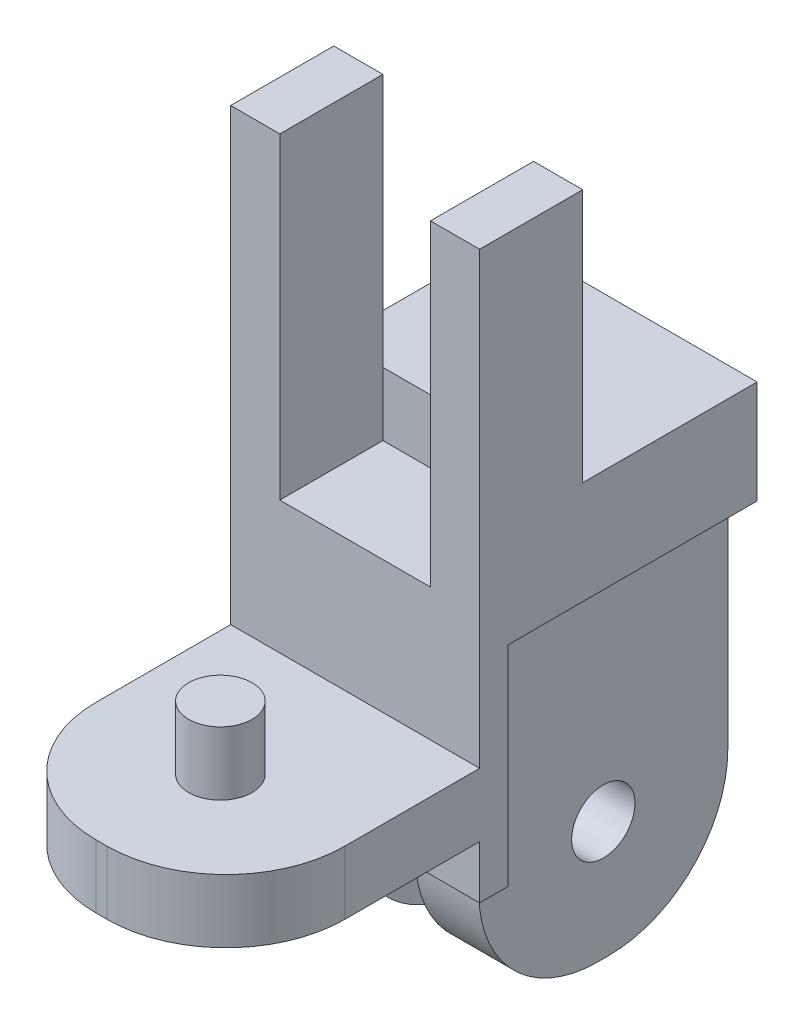
from build123d import *

# Parameters (mm, degrees)
SKETCH4_W            = 31.4
SKETCH4_H            = 31.4
SKETCH4_W_2          = 25.4
SKETCH4_H_2          = 25.4
BOSS_EXTRUDE3_DEPTH  = 30
SKETCH5_W            = 31.4
SKETCH5_H            = 31.4
BOSS_EXTRUDE4_DEPTH  = 5
SKETCH6_W            = 31.4
SKETCH6_H            = 8
BOSS_EXTRUDE5_DEPTH  = 5
BOSS_EXTRUDE6_DEPTH  = 8
SKETCH8_R            = 4
BOSS_EXTRUDE7_DEPTH  = 8
SKETCH9_W            = 31.4
SKETCH9_H            = 10
BOSS_EXTRUDE8_DEPTH  = 5
SKETCH10_W           = 31.4
SKETCH10_H           = 10
BOSS_EXTRUDE9_DEPTH  = 13
SKETCH11_W           = 6.2
SKETCH11_H           = 10
BOSS_EXTRUDE10_DEPTH = 40
BOSS_EXTRUDE11_DEPTH = 3
SKETCH13_W           = 31.4
SKETCH13_H           = 31.4
CUT_EXTRUDE1_DEPTH   = 31.4
SKETCH15_W           = 31.4
SKETCH15_H           = 13
BOSS_EXTRUDE12_DEPTH = 12
SKETCH17_W           = 8
SKETCH17_H           = 31.4
BOSS_EXTRUDE13_DEPTH = 10
SKETCH18_R           = 4
BOSS_EXTRUDE14_DEPTH = 8
SKETCH19_W           = 3.6
SKETCH19_H           = 5
CUT_EXTRUDE2_DEPTH   = 31.4
SKETCH20_W           = 8
SKETCH20_H           = 1
CUT_EXTRUDE3_DEPTH   = 26.4


with BuildPart() as part:
    # Sketch4 → Boss-Extrude3 (new body)
    with BuildSketch(Plane.XY):
        Rectangle(SKETCH4_W, SKETCH4_H)
        Rectangle(SKETCH4_W_2, SKETCH4_H_2, mode=Mode.SUBTRACT)
    extrude(amount=BOSS_EXTRUDE3_DEPTH)

    # Sketch5 → Boss-Extrude4 (add)
    with BuildSketch(Plane.XY.offset(30)):
        Rectangle(SKETCH5_W, SKETCH5_H)
    extrude(amount=BOSS_EXTRUDE4_DEPTH)

    # Sketch6 → Boss-Extrude5 (add)
    with BuildSketch(Plane.XY.offset(35)):
        Rectangle(SKETCH6_W, SKETCH6_H)
    extrude(amount=BOSS_EXTRUDE5_DEPTH)

    # Sketch7 → Boss-Extrude6 (add)
    with BuildSketch(Plane.XZ.offset(4)):
        with BuildLine():
            Line((-15.7, 40), (-15.7, 52))
            ThreePointArc((-15.7, 52), (-11.306601718, 62.606601718), (-0.7, 67))
            Line((-0.7, 67), (0.7, 67))
            ThreePointArc((0.7, 67), (11.306601718, 62.606601718), (15.7, 52))
            Line((15.7, 52), (15.7, 40))
            Line((15.7, 40), (-15.7, 40))
        make_face()
    extrude(amount=-BOSS_EXTRUDE6_DEPTH)

    # Sketch8 → Boss-Extrude7 (add)
    with BuildSketch(Plane.XZ.offset(4)):
        with Locations(Location((0, 52, 0), (0, 0, 180))):
            Circle(SKETCH8_R)
    boss_extrude7 = extrude(amount=BOSS_EXTRUDE7_DEPTH)

    # Mirror1: Boss-Extrude7 across plane
    add(boss_extrude7.mirror(Plane.ZX))

    # Sketch9 → Boss-Extrude8 (add)
    with BuildSketch(Plane(origin=(0, 15.7, 0), x_dir=(1, 0, 0), z_dir=(0, 1, 0))):
        with Locations((0, -27)):
            Rectangle(SKETCH9_W, SKETCH9_H)
    extrude(amount=BOSS_EXTRUDE8_DEPTH)

    # Sketch10 → Boss-Extrude9 (add)
    with BuildSketch(Plane(origin=(0, 15.7, 0), x_dir=(1, 0, 0), z_dir=(0, 1, 0))):
        with Locations((0, -17)):
            Rectangle(SKETCH10_W, SKETCH10_H)
    extrude(amount=BOSS_EXTRUDE9_DEPTH)

    # Sketch11 → Boss-Extrude10 (add)
    with BuildSketch(Plane(origin=(0, 20.7, 0), x_dir=(1, 0, 0), z_dir=(0, 1, 0))):
        with Locations((-12.6, -27)):
            Rectangle(SKETCH11_W, SKETCH11_H)
        with Locations((12.6, -27)):
            Rectangle(SKETCH11_W, SKETCH11_H)
    extrude(amount=BOSS_EXTRUDE10_DEPTH)

    # Sketch12 → Boss-Extrude11 (add)
    with BuildSketch(Plane.XY.offset(32)):
        Polygon((-15.7, 60.7), (-9.5, 60.7), (-9.5, 20.7), (9.5, 20.7), (9.5, 60.7), (15.7, 60.7), (15.7, 15.7), (-15.7, 15.7), align=None)
    extrude(amount=BOSS_EXTRUDE11_DEPTH)

    # Sketch13 → Cut-Extrude1 (cut)
    with BuildSketch(Plane.ZY.offset(15.7)):
        with Locations((15.7, 0)):
            Rectangle(SKETCH13_W, SKETCH13_H)
    extrude(amount=-CUT_EXTRUDE1_DEPTH, mode=Mode.SUBTRACT)

    # Sketch15 → Boss-Extrude12 (add)
    with BuildSketch(Plane(origin=(0, 0, 12), x_dir=(-1, 0, 0), z_dir=(0, 0, -1))):
        with Locations((0, 22.2)):
            Rectangle(SKETCH15_W, SKETCH15_H)
    extrude(amount=BOSS_EXTRUDE12_DEPTH)

    # Sketch17 → Boss-Extrude13 (add)
    with BuildSketch(Plane.XZ.offset(-15.7)):
        with Locations((-8, 15.7)):
            Rectangle(SKETCH17_W, SKETCH17_H)
    boss_extrude13 = extrude(amount=BOSS_EXTRUDE13_DEPTH)

    # Sketch18 → Boss-Extrude14 (add)
    with BuildSketch(Plane.ZY.offset(12)):
        with BuildLine():
            Line((31.4, 5.7), (0, 5.7))
            Line((0, 5.7), (0, -13.3))
            ThreePointArc((0, -13.3), (4.393398282, -23.906601718), (15, -28.3))
            Line((15, -28.3), (16.4, -28.3))
            ThreePointArc((16.4, -28.3), (27.006601718, -23.906601718), (31.4, -13.3))
            Line((31.4, -13.3), (31.4, 5.7))
        make_face()
        with Locations((15.7, -13.3)):
            Circle(SKETCH18_R, mode=Mode.SUBTRACT)
    boss_extrude14 = extrude(amount=-BOSS_EXTRUDE14_DEPTH)

    # Mirror3: Boss-Extrude13, Boss-Extrude14 across plane
    add(boss_extrude13.mirror(Plane(origin=(0, 0, 0), x_dir=(0, 0, 1), z_dir=(1, 0, 0))))
    add(boss_extrude14.mirror(Plane(origin=(0, 0, 0), x_dir=(0, 0, 1), z_dir=(1, 0, 0))))

    # Sketch19 → Cut-Extrude2 (cut)
    with BuildSketch(Plane(origin=(15.7, 0, 0), x_dir=(0, 0, -1), z_dir=(1, 0, 0))):
        with Locations((-33.2, -13.2)):
            Rectangle(SKETCH19_W, SKETCH19_H)
    extrude(amount=-CUT_EXTRUDE2_DEPTH, mode=Mode.SUBTRACT)

    # Sketch20 → Cut-Extrude3 (cut)
    with BuildSketch(Plane.XZ.offset(10.7)):
        with Locations((0, 31.9)):
            Rectangle(SKETCH20_W, SKETCH20_H)
    extrude(amount=-CUT_EXTRUDE3_DEPTH, mode=Mode.SUBTRACT)


solid = part.part
